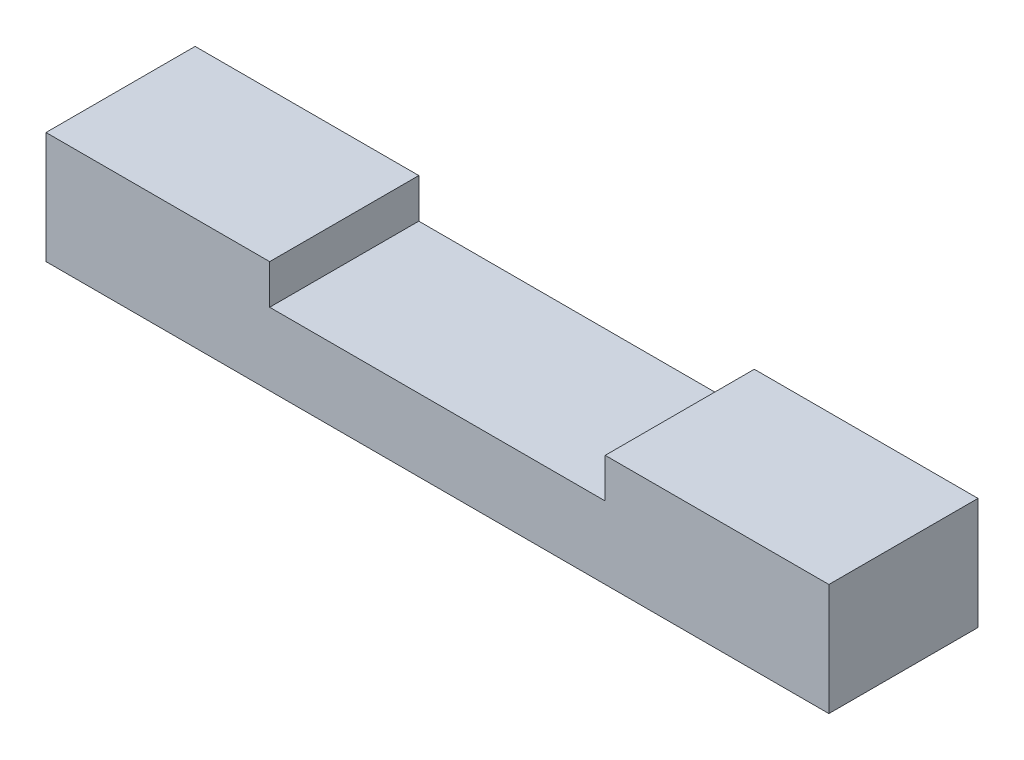
from build123d import *

# Parameters (mm, degrees)
EXTRUDE_1_DEPTH = 200


with BuildPart() as part:
    # 草图1 → 凸台-拉伸1 (new body)
    with BuildSketch(Plane.XY):
        Polygon((0, 0), (1050, 0), (1050, 150), (750, 150), (750, 97), (300, 97), (300, 150), (0, 150), align=None)
    extrude(amount=EXTRUDE_1_DEPTH)


solid = part.part
